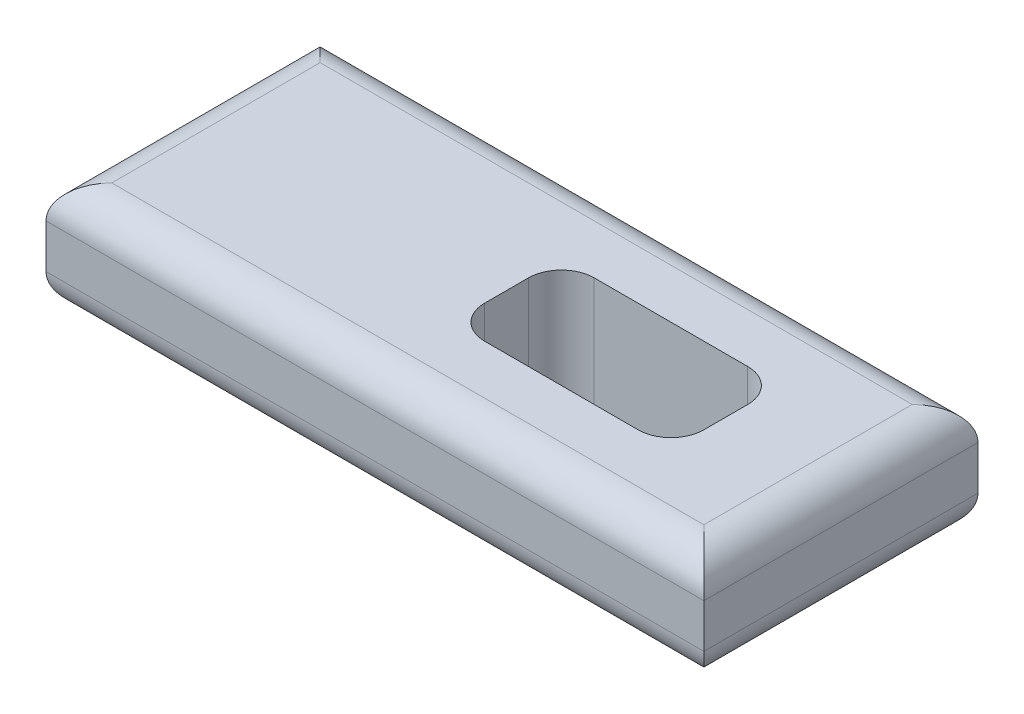
from build123d import *

# Parameters (mm, degrees)
ESBO_O2_W                = 120
ESBO_O2_H                = 50
RESSALTO_EXTRUS_O1_DEPTH = 20
FILETE1_R                = 6
ESBO_O3_W                = 40
ESBO_O3_H                = 20
CORTE_EXTRUS_O1_DEPTH    = 132.52946438
FILETE2_R                = 6


with BuildPart() as part:
    # Esboço2 → Ressalto-extrusão1 (new body)
    with BuildSketch(Plane(origin=(0, 0, 0), x_dir=(1, 0, 0), z_dir=(0, 1, 0))):
        with Locations((60, 25)):
            Rectangle(ESBO_O2_W, ESBO_O2_H)
    extrude(amount=RESSALTO_EXTRUS_O1_DEPTH)

    # Filete1
    filete1_edges = [part.edges().sort_by_distance(p)[0] for p in [
        (120, 20, -25),
        (60, 20, -50),
        (0, 20, -25),
        (60, 0, -50),
        (120, 0, -25),
        (60, 0, 0),
        (0, 0, -25),
        (60, 20, 0),
    ]]
    fillet(filete1_edges, radius=FILETE1_R)

    # Esboço3 → Corte-extrusão1 (cut, through all)
    with BuildSketch(Plane(origin=(0, 20, 0), x_dir=(1, 0, 0), z_dir=(0, 1, 0))):
        with Locations((79, 25)):
            Rectangle(ESBO_O3_W, ESBO_O3_H)
    extrude(amount=-CORTE_EXTRUS_O1_DEPTH, mode=Mode.SUBTRACT)

    # Filete2
    filete2_edges = [part.edges().sort_by_distance(p)[0] for p in [
        (59, 10, -15),
        (59, 10, -35),
        (99, 10, -35),
        (99, 10, -15),
    ]]
    fillet(filete2_edges, radius=FILETE2_R)


solid = part.part
